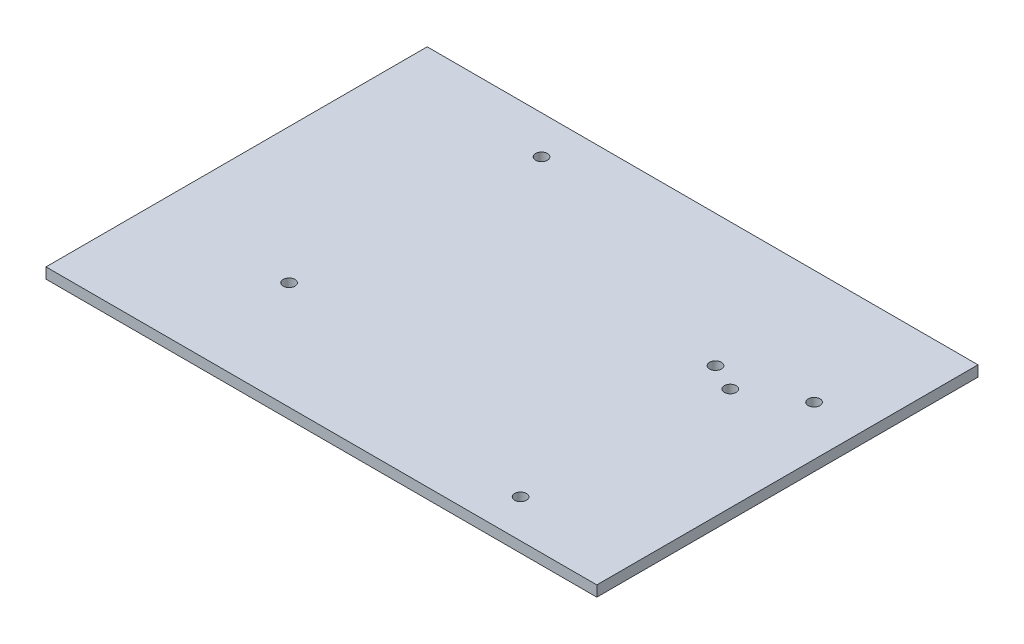
from build123d import *

# Parameters (mm, degrees)
SKETCH1_W           = 144.5
SKETCH1_H           = 100
SKETCH1_R           = 1.55
BOSS_EXTRUDE1_DEPTH = 2.8
CUT_EXTRUDE1_REACH  = 89.908
SKETCH2_R           = 1.55
CUT_EXTRUDE2_REACH  = 89.908
SKETCH3_R           = 1.55


with BuildPart() as part:
    # Sketch1 → Boss-Extrude1 (new body)
    with BuildSketch(Plane(origin=(0, 0, 0), x_dir=(1, 0, 0), z_dir=(0, 1, 0))):
        Rectangle(SKETCH1_W, SKETCH1_H)
        with Locations(Location((-32.25, 40, 0), (0, 0, 270))):
            Circle(SKETCH1_R, mode=Mode.SUBTRACT)
        with Locations(Location((59.25, 20, 0), (0, 0, 270))):
            Circle(SKETCH1_R, mode=Mode.SUBTRACT)
        with Locations(Location((42.25, -40, 0), (0, 0, 270))):
            Circle(SKETCH1_R, mode=Mode.SUBTRACT)
    extrude(amount=BOSS_EXTRUDE1_DEPTH)

    # Sketch2 → Cut-Extrude1 (cut, up to next)
    with BuildSketch(Plane(origin=(0, 2.8, 0), x_dir=(1, 0, 0), z_dir=(0, 1, 0)), mode=Mode.PRIVATE) as cut_extrude1_sk1:
        with Locations(Location((-36.75, -21.73, 0), (0, 0, 270))):
            Circle(SKETCH2_R)
    cut_extrude1_tool1 = extrude(cut_extrude1_sk1.sketch, amount=-CUT_EXTRUDE1_REACH, mode=Mode.PRIVATE) & part.part
    add(cut_extrude1_tool1.solids().sort_by_distance((-36.75, 2.8, 21.73))[0], mode=Mode.SUBTRACT)

    # Sketch3 → Cut-Extrude2 (cut, up to next)
    with BuildSketch(Plane(origin=(0, 2.8, 0), x_dir=(1, 0, 0), z_dir=(0, 1, 0)), mode=Mode.PRIVATE) as cut_extrude2_sk1:
        with Locations(Location((37.999537704, 15.380946094, 0), (0, 0, 270))):
            Circle(SKETCH3_R)
    cut_extrude2_tool1 = extrude(cut_extrude2_sk1.sketch, amount=-CUT_EXTRUDE2_REACH, mode=Mode.PRIVATE) & part.part
    # Sketch3 → Cut-Extrude2 (cut, up to next)
    with BuildSketch(Plane(origin=(0, 2.8, 0), x_dir=(1, 0, 0), z_dir=(0, 1, 0)), mode=Mode.PRIVATE) as cut_extrude2_sk2:
        with Locations(Location((45.25, 12, 0), (0, 0, 270))):
            Circle(SKETCH3_R)
    cut_extrude2_tool2 = extrude(cut_extrude2_sk2.sketch, amount=-CUT_EXTRUDE2_REACH, mode=Mode.PRIVATE) & part.part
    add(cut_extrude2_tool1.solids().sort_by_distance((37.999538, 2.8, -15.380946))[0], mode=Mode.SUBTRACT)
    add(cut_extrude2_tool2.solids().sort_by_distance((45.25, 2.8, -12))[0], mode=Mode.SUBTRACT)


solid = part.part
